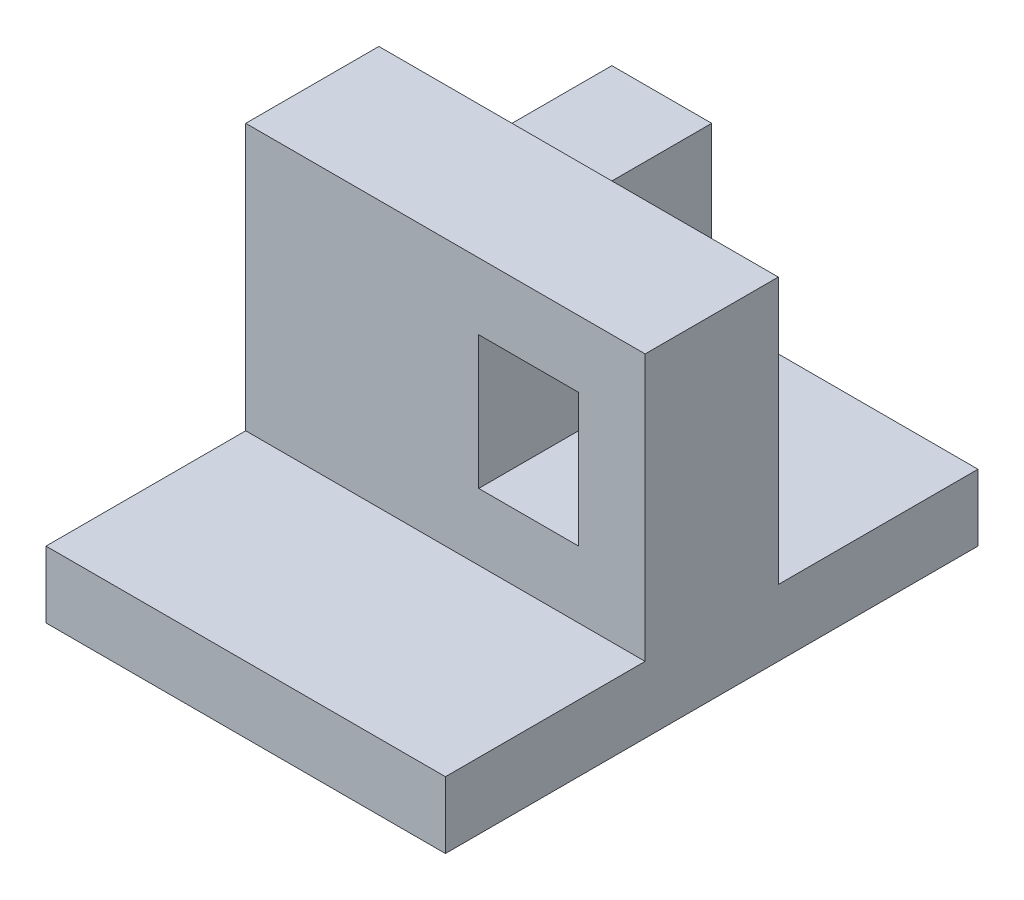
from build123d import *

# Parameters (mm, degrees)
ESBO_O1_W                = 60
ESBO_O1_H                = 10
RESSALTO_EXTRUS_O1_DEPTH = 80
ESBO_O2_W                = 20
ESBO_O2_H                = 40
RESSALTO_EXTRUS_O2_DEPTH = 60
ESBO_O3_W                = 15
ESBO_O3_H                = 20
CORTE_EXTRUS_O1_DEPTH    = 60
ESBO_O4_W                = 15
ESBO_O4_H                = 20
RESSALTO_EXTRUS_O3_DEPTH = 45


with BuildPart() as part:
    # Esboço1 → Ressalto-extrusão1 (new body)
    with BuildSketch(Plane.XY):
        with Locations((-30, 5)):
            Rectangle(ESBO_O1_W, ESBO_O1_H)
    extrude(amount=RESSALTO_EXTRUS_O1_DEPTH)

    # Esboço2 → Ressalto-extrusão2 (add)
    with BuildSketch(Plane.ZY.offset(60)):
        with Locations((40, 30)):
            Rectangle(ESBO_O2_W, ESBO_O2_H)
    extrude(amount=-RESSALTO_EXTRUS_O2_DEPTH)

    # Esboço3 → Corte-extrusão1 (cut)
    with BuildSketch(Plane.XY.offset(50)):
        with Locations((-17.5, 30)):
            Rectangle(ESBO_O3_W, ESBO_O3_H)
        with Locations((-42.5, 30)):
            Rectangle(ESBO_O3_W, ESBO_O3_H)
    extrude(amount=-CORTE_EXTRUS_O1_DEPTH, mode=Mode.SUBTRACT)

    # Esboço4 → Ressalto-extrusão3 (add)
    with BuildSketch(Plane.XY.offset(50)):
        with Locations((-42.5, 30)):
            Rectangle(ESBO_O4_W, ESBO_O4_H)
    extrude(amount=-RESSALTO_EXTRUS_O3_DEPTH)


solid = part.part
